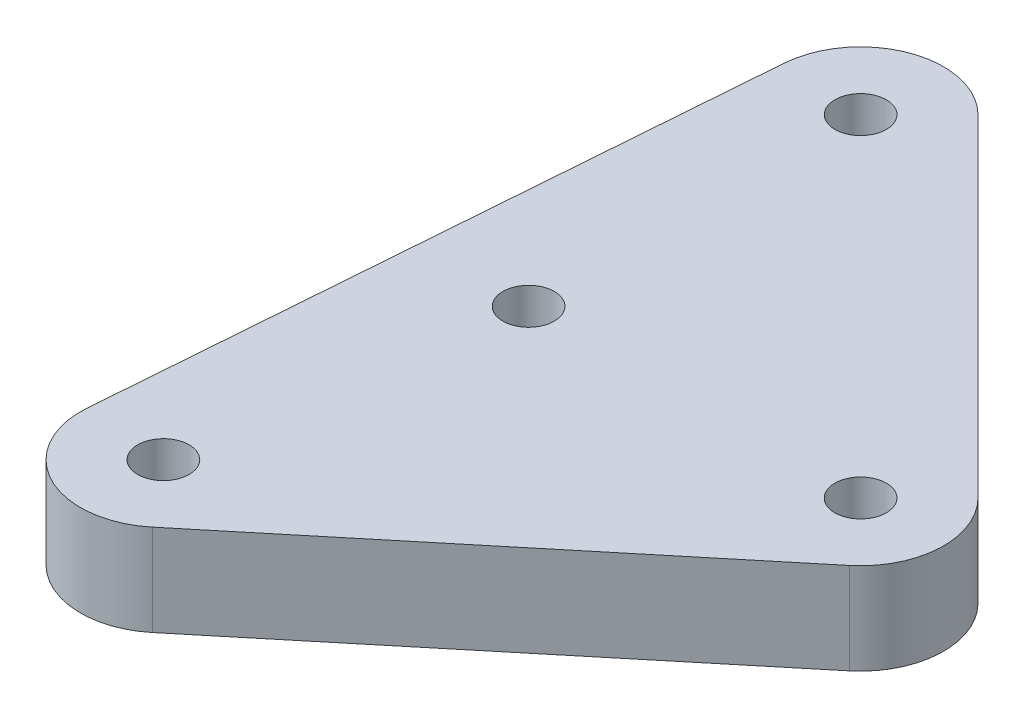
from build123d import *

# Parameters (mm, degrees)
SKETCH_1_R      = 1.55
EXTRUDE_1_DEPTH = 5.5


with BuildPart() as part:
    # ｽｹｯﾁ1 → ﾎﾞｽ - 押し出し1 (new body)
    with BuildSketch(Plane(origin=(0, 0, 0), x_dir=(1, 0, 0), z_dir=(0, 1, 0))):
        with BuildLine():
            Line((-7.985272428, -18.616517506), (-4.985272428, 20.383482494))
            ThreePointArc((-4.985272428, 20.383482494), (-1.734731239, 24.689425075), (3.535533906, 23.535533906))
            Line((3.535533906, 23.535533906), (23.535533906, 3.535533906))
            ThreePointArc((23.535533906, 3.535533906), (24.994366167, -0.237290102), (23.184407235, -3.854808758))
            Line((23.184407235, -3.854808758), (0.184407235, -22.854808758))
            ThreePointArc((0.184407235, -22.854808758), (-5.302511031, -23.438292797), (-7.985272428, -18.616517506))
        make_face()
        with Locations(Location((0, 20, 0), (0, 0, 270))):
            Circle(SKETCH_1_R, mode=Mode.SUBTRACT)
        with Locations(Location((0, 0, 0), (0, 0, 270))):
            Circle(SKETCH_1_R, mode=Mode.SUBTRACT)
        with Locations(Location((20, 0, 0), (0, 0, 270))):
            Circle(SKETCH_1_R, mode=Mode.SUBTRACT)
        with Locations(Location((-3, -19, 0), (0, 0, 270))):
            Circle(SKETCH_1_R, mode=Mode.SUBTRACT)
    extrude(amount=EXTRUDE_1_DEPTH)


solid = part.part
